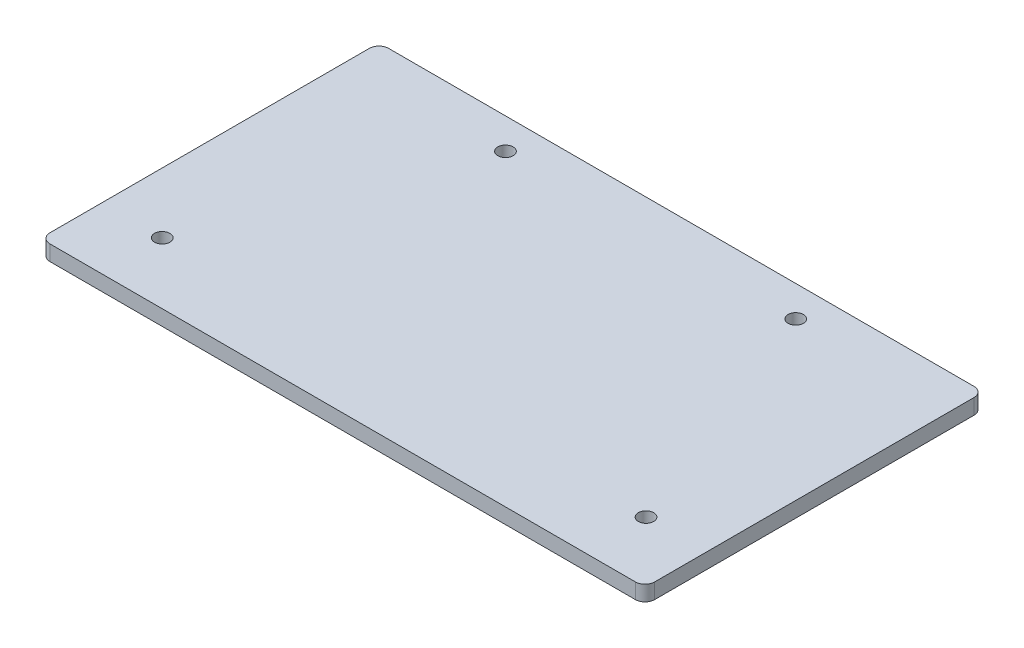
from build123d import *

# Parameters (mm, degrees)
SKETCH1_R           = 1.5875
BOSS_EXTRUDE1_DEPTH = 3.175


with BuildPart() as part:
    # Sketch1 → Boss-Extrude1 (new body)
    with BuildSketch(Plane(origin=(0, 0, 0), x_dir=(1, 0, 0), z_dir=(0, 1, 0))):
        with BuildLine():
            Line((-60.5, 0), (60.5, 0))
            ThreePointArc((60.5, 0), (61.914213562, -0.585786438), (62.5, -2))
            Line((62.5, -2), (62.5, -68))
            ThreePointArc((62.5, -68), (61.914213562, -69.414213562), (60.5, -70))
            Line((60.5, -70), (-60.5, -70))
            ThreePointArc((-60.5, -70), (-61.914213562, -69.414213562), (-62.5, -68))
            Line((-62.5, -68), (-62.5, -2))
            ThreePointArc((-62.5, -2), (-61.914213562, -0.585786438), (-60.5, 0))
        make_face()
        with Locations(Location((-30, -6.35, 0), (0, 0, 270))):
            Circle(SKETCH1_R, mode=Mode.SUBTRACT)
        with Locations(Location((30, -6.35, 0), (0, 0, 270))):
            Circle(SKETCH1_R, mode=Mode.SUBTRACT)
        with Locations(Location((-50, -57.3, 0), (0, 0, 270))):
            Circle(SKETCH1_R, mode=Mode.SUBTRACT)
        with Locations(Location((50, -57.3, 0), (0, 0, 270))):
            Circle(SKETCH1_R, mode=Mode.SUBTRACT)
    extrude(amount=BOSS_EXTRUDE1_DEPTH)


solid = part.part
